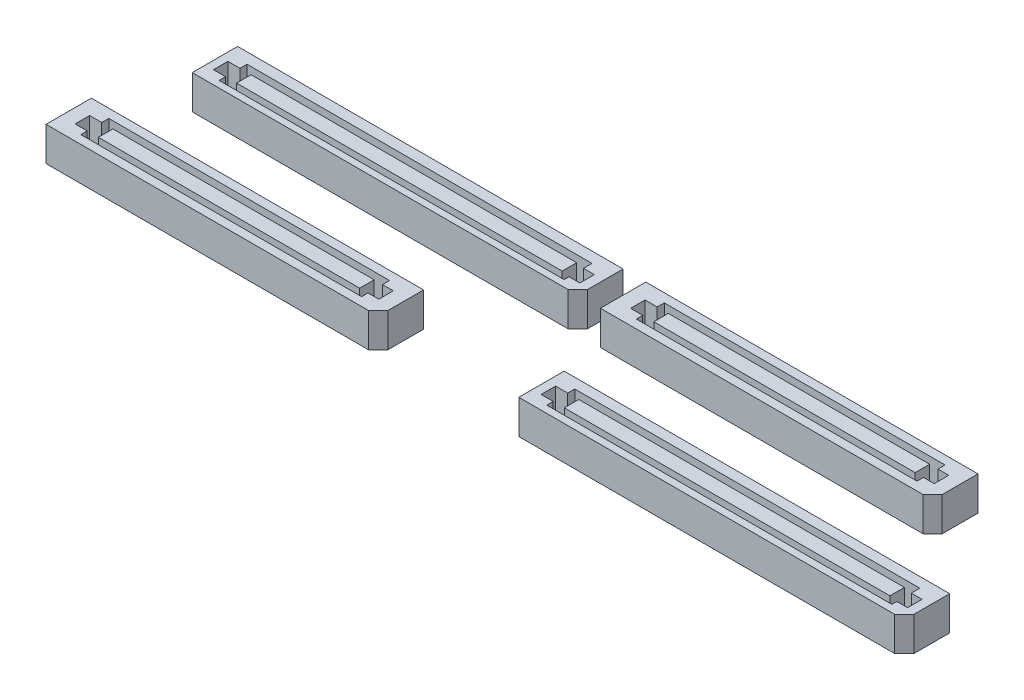
from build123d import *

# Parameters (mm, degrees)
SV_DEPTH           = 3.75
SV_2_DEPTH         = 3.75
SV_3_DEPTH         = 3.75
SV_4_DEPTH         = 3.75
SKETCH3_W          = 28.811718275
SKETCH3_H          = 1.597828601
SKETCH3_W_2        = 35.897762959
SKETCH3_W_3        = 35.897762958
CUT_EXTRUDE1_DEPTH = 3.5


with BuildPart() as part:
    # Sketch1 → SV (new body)
    with BuildSketch(Plane(origin=(0, 0, 0), x_dir=(1, 0, 0), z_dir=(0, 1, 0))):
        Polygon((55.811, 9.5), (97.25, 9.5), (97.25, 5.56), (96.19, 4.5), (54.75, 4.5), (54.75, 8.439), (54.75, 9.5), align=None)
    extrude(amount=SV_DEPTH)


with BuildPart() as body_2:
    # Sketch1 → SV 2 (new body)
    with BuildSketch(Plane(origin=(0, 0, 0), x_dir=(1, 0, 0), z_dir=(0, 1, 0))):
        Polygon((3.686, 9.5), (39.25, 9.5), (39.25, 5.555), (38.195, 4.5), (2.625, 4.5), (2.625, 8.439), (2.625, 9.5), align=None)
    extrude(amount=SV_2_DEPTH)


with BuildPart() as body_3:
    # Sketch1 → SV 3 (new body)
    with BuildSketch(Plane(origin=(0, 0, 0), x_dir=(1, 0, 0), z_dir=(0, 1, 0))):
        Polygon((51.811, 22.5), (87.375, 22.5), (87.375, 18.555), (86.32, 17.5), (50.75, 17.5), (50.75, 21.439), (50.75, 22.5), align=None)
    extrude(amount=SV_3_DEPTH)


with BuildPart() as body_4:
    # Sketch1 → SV 4 (new body)
    with BuildSketch(Plane(origin=(0, 0, 0), x_dir=(1, 0, 0), z_dir=(0, 1, 0))):
        Polygon((6.811, 22.5), (48.25, 22.5), (48.25, 18.56), (47.19, 17.5), (5.75, 17.5), (5.75, 21.439), (5.75, 22.5), align=None)
    extrude(amount=SV_4_DEPTH)


with BuildPart() as cut_extrude1_tool:
    # Sketch3 → Cut-Extrude1 (new body)
    # profile 1 of 4: a face of its own
    with BuildSketch(Plane(origin=(0, 3.75, 0), x_dir=(1, 0, 0), z_dir=(0, 1, 0))):
        Polygon((4.189336253, 7.745735487), (5.524337048, 7.745735487), (5.524337048, 8.524173538), (36.475691419, 8.524173538), (36.475691419, 7.745735487), (37.666991912, 7.745735487), (37.666991912, 6.147906886), (36.475691419, 6.147906886), (36.475691419, 5.438560322), (5.524337048, 5.438560322), (5.524337048, 6.147906886), (4.189336253, 6.147906886), align=None)
        with Locations((21.152985591, 6.946821187)):
            Rectangle(SKETCH3_W, SKETCH3_H, mode=Mode.SUBTRACT)
    # profile 2 of 4: a face of its own
    with BuildSketch(Plane(origin=(0, 3.75, 0), x_dir=(1, 0, 0), z_dir=(0, 1, 0))):
        Polygon((52.421116037, 20.753597434), (53.756116831, 20.753597434), (53.756116831, 21.532035485), (84.707471203, 21.532035485), (84.707471203, 20.753597434), (85.898771695, 20.753597434), (85.898771695, 19.155768833), (84.707471203, 19.155768833), (84.707471203, 18.446422269), (53.756116831, 18.446422269), (53.756116831, 19.155768833), (52.421116037, 19.155768833), align=None)
        with Locations((69.384765375, 19.954683133)):
            Rectangle(SKETCH3_W, SKETCH3_H, mode=Mode.SUBTRACT)
    # profile 3 of 4: a face of its own
    with BuildSketch(Plane(origin=(0, 3.75, 0), x_dir=(1, 0, 0), z_dir=(0, 1, 0))):
        Polygon((55.705906871, 7.599031898), (57.040907666, 7.599031898), (57.040907666, 8.377469948), (95.07830672, 8.377469948), (95.07830672, 7.437727621), (96.269607213, 7.437727621), (96.269607213, 5.83989902), (95.07830672, 5.83989902), (95.07830672, 5.291856733), (57.040907666, 5.291856733), (57.040907666, 6.001203297), (55.705906871, 6.001203297), align=None)
        with Locations((76.21257855, 6.800117597)):
            Rectangle(SKETCH3_W_2, SKETCH3_H, mode=Mode.SUBTRACT)
    # profile 4 of 4: a face of its own
    with BuildSketch(Plane(origin=(0, 3.75, 0), x_dir=(1, 0, 0), z_dir=(0, 1, 0))):
        Polygon((6.636601859, 20.53972103), (7.971602653, 20.53972103), (7.971602653, 21.318159081), (46.009001708, 21.318159081), (46.009001708, 20.378416754), (47.2003022, 20.378416754), (47.2003022, 18.780588153), (46.009001708, 18.780588153), (46.009001708, 18.232545866), (7.971602653, 18.232545866), (7.971602653, 18.941892429), (6.636601859, 18.941892429), align=None)
        with Locations((27.143273538, 19.74080673)):
            Rectangle(SKETCH3_W_3, SKETCH3_H, mode=Mode.SUBTRACT)
    extrude(amount=-CUT_EXTRUDE1_DEPTH)


with BuildPart() as part_1:
    add(part.part)

    # Cut-Extrude1: cut by cut_extrude1_tool
    add(cut_extrude1_tool.part, mode=Mode.SUBTRACT)


with BuildPart() as body_2_1:
    add(body_2.part)

    # Cut-Extrude1: cut by cut_extrude1_tool
    add(cut_extrude1_tool.part, mode=Mode.SUBTRACT)


with BuildPart() as body_3_1:
    add(body_3.part)

    # Cut-Extrude1: cut by cut_extrude1_tool
    add(cut_extrude1_tool.part, mode=Mode.SUBTRACT)


with BuildPart() as body_4_1:
    add(body_4.part)

    # Cut-Extrude1: cut by cut_extrude1_tool
    add(cut_extrude1_tool.part, mode=Mode.SUBTRACT)


solid = Compound([part_1.part, body_2_1.part, body_3_1.part, body_4_1.part])
